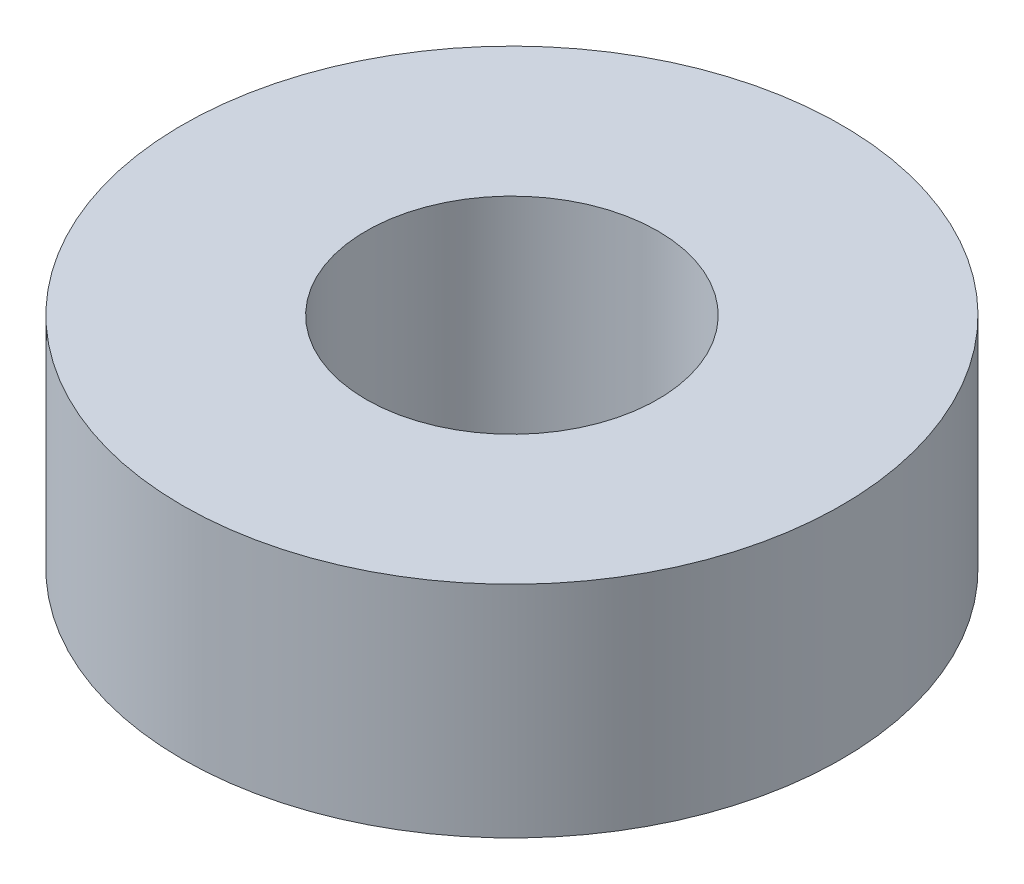
from build123d import *

# Parameters (mm, degrees)
SKETCH1_R           = 4.7625
SKETCH1_R_2         = 2.1082
BOSS_EXTRUDE1_DEPTH = 3.175


with BuildPart() as part:
    # Sketch1 → Boss-Extrude1 (new body)
    with BuildSketch(Plane(origin=(0, 0, 0), x_dir=(1, 0, 0), z_dir=(0, 1, 0))):
        with Locations(Location((0, 0, 0), (0, 0, 270))):
            Circle(SKETCH1_R)
        with Locations(Location((0, 0, 0), (0, 0, 270))):
            Circle(SKETCH1_R_2, mode=Mode.SUBTRACT)
    extrude(amount=BOSS_EXTRUDE1_DEPTH)


solid = part.part
